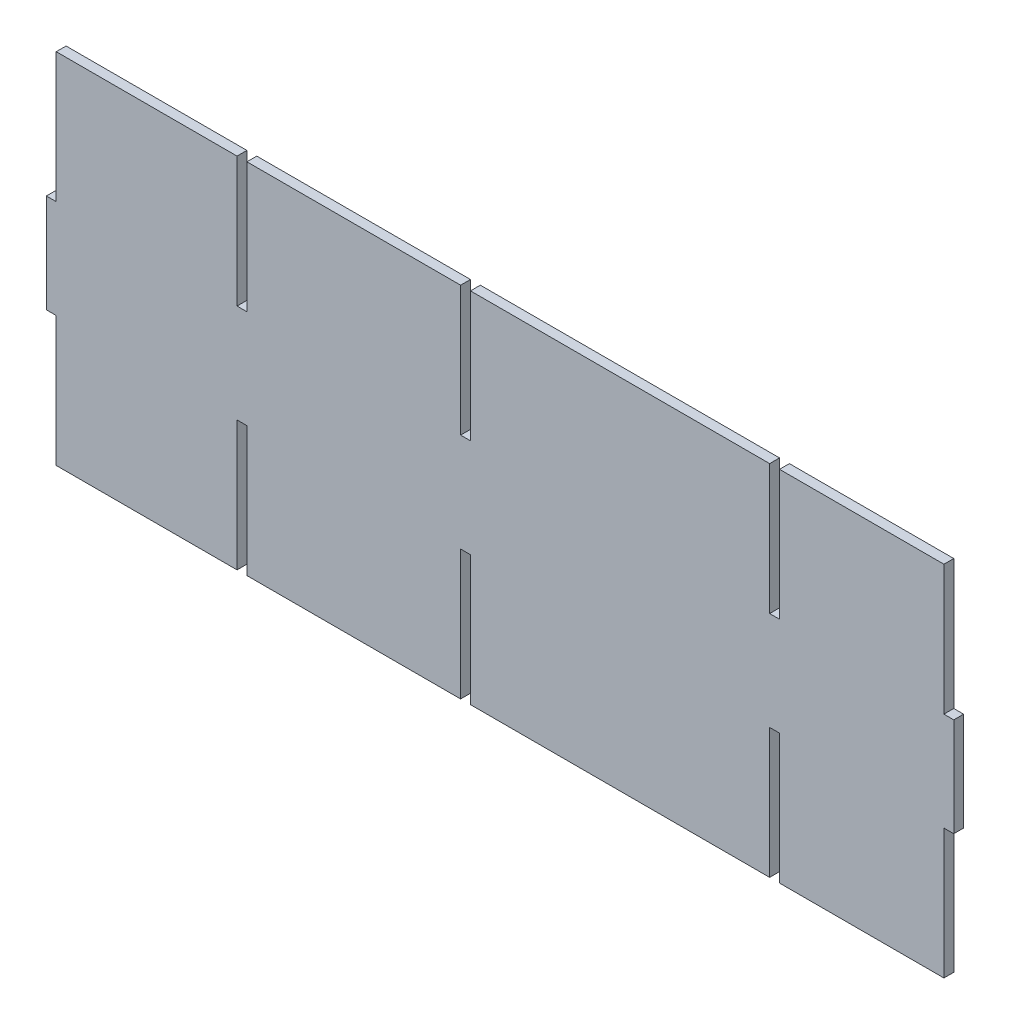
from build123d import *

# Parameters (mm, degrees)
BOSS_EXTRUDE1_DEPTH = 3


with BuildPart() as part:
    # Sketch1 → Boss-Extrude1 (new body)
    with BuildSketch(Plane.XY):
        Polygon((0, 0), (3, 0), (3, -39.5), (58, -39.5), (58, 0), (61, 0), (61, -39.5), (126, -39.5), (126, 0), (129, 0), (129, -39.5), (220, -39.5), (220, 0), (223, 0), (223, -39.5), (273, -39.5), (273, 0), (276, 0), (276, 30), (273, 30), (273, 69.5), (223, 69.5), (223, 30), (220, 30), (220, 69.5), (129, 69.5), (129, 30), (126, 30), (126, 69.5), (61, 69.5), (61, 30), (58, 30), (58, 69.5), (3, 69.5), (3, 30), (0, 30), align=None)
    extrude(amount=BOSS_EXTRUDE1_DEPTH)


solid = part.part
